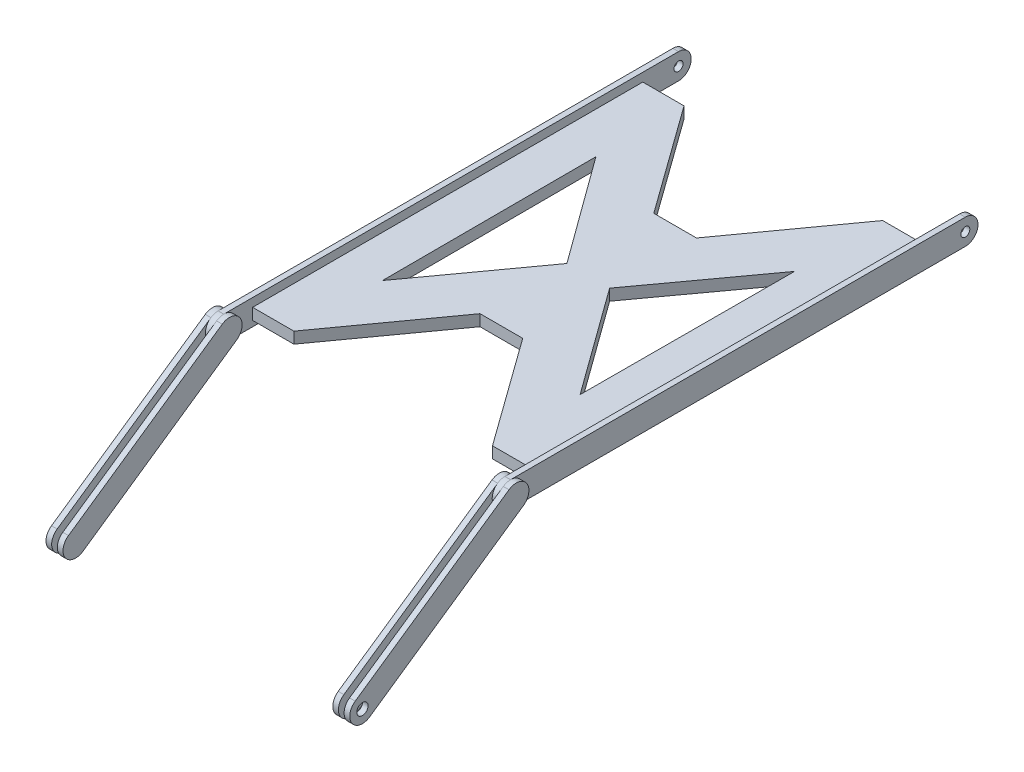
from build123d import *

# Parameters (mm, degrees)
BOSS_EXTRUDE1_DEPTH  = 6.35
BOSS_EXTRUDE2_DEPTH  = 3.175
BOSS_EXTRUDE3_DEPTH  = 3.175
SKETCH6_R            = 3.175
CUT_EXTRUDE1_DEPTH   = 283.34881494
MIRROR4_COPY_1_DEPTH = 3.175
SKETCH7_R            = 2.54
CUT_EXTRUDE2_DEPTH   = 283.34881494


with BuildPart() as part:
    # Sketch3 → Boss-Extrude1 (new body)
    with BuildSketch(Plane(origin=(0, 0, 0), x_dir=(1, 0, 0), z_dir=(0, 1, 0))):
        Polygon((-78.779496576, 109.348374591), (-78.779496576, -109.348374591), (-55.662733102, -109.348374591), (-11.971276007, -48.703282599), (11.971276007, -48.703282599), (55.662733102, -109.348374591), (78.779496576, -109.348374591), (78.779496576, 109.348374591), (55.662733102, 109.348374591), (11.971276007, 48.703282599), (-11.971276007, 48.703282599), (-55.662733102, 109.348374591), align=None)
        Polygon((-11.971276007, 0), (-55.378618761, -59.954544833), (-55.662733102, 59.954544833), align=None, mode=Mode.SUBTRACT)
        Polygon((11.971276007, 0), (55.662733102, 59.954544833), (55.378618761, -59.954544833), align=None, mode=Mode.SUBTRACT)
    extrude(amount=BOSS_EXTRUDE1_DEPTH)

    # Sketch4 → Boss-Extrude2 (add)
    with BuildSketch(Plane(origin=(78.779496576, 0, 0), x_dir=(0, 0, -1), z_dir=(1, 0, 0))):
        with BuildLine():
            Line((-125.508834583, 11.113906265), (129.384720174, 11.113906265))
            ThreePointArc((129.384720174, 11.113906265), (136.501721079, 3.99690536), (129.384720174, -3.120095546))
            Line((129.384720174, -3.120095546), (-125.508834583, -3.120095546))
            ThreePointArc((-125.508834583, -3.120095546), (-132.625835488, 3.99690536), (-125.508834583, 11.113906265))
        make_face()
    boss_extrude2 = extrude(amount=BOSS_EXTRUDE2_DEPTH)

    # Mirror1: Boss-Extrude2 across plane
    add(boss_extrude2.mirror(Plane(origin=(0, 0, 0), x_dir=(0, 0, 1), z_dir=(1, 0, 0))))

    # Sketch5 → Boss-Extrude3 (add)
    with BuildSketch(Plane(origin=(81.954496576, 0, 0), x_dir=(0, 0, -1), z_dir=(1, 0, 0))):
        with BuildLine():
            Line((-121.468100538, -1.855701955), (-207.665903416, -61.368048827))
            ThreePointArc((-207.665903416, -61.368048827), (-217.559244776, -59.556175556), (-215.747371505, -49.662834197))
            Line((-215.747371505, -49.662834197), (-129.549568627, 9.849512675))
            ThreePointArc((-129.549568627, 9.849512675), (-119.656227268, 8.037639404), (-121.468100538, -1.855701955))
        make_face()
    boss_extrude3 = extrude(amount=BOSS_EXTRUDE3_DEPTH)

    # Sketch6 → Cut-Extrude1 (cut, through all)
    with BuildSketch(Plane(origin=(85.129496576, 0, 0), x_dir=(0, 0, -1), z_dir=(1, 0, 0))):
        with Locations((-211.706637461, -55.515441512)):
            Circle(SKETCH6_R)
    extrude(amount=-CUT_EXTRUDE1_DEPTH, mode=Mode.SUBTRACT)

    # Mirror3: Boss-Extrude3 across plane
    add(boss_extrude3.mirror(Plane(origin=(80.366996576, 0, 0), x_dir=(0, 0, 1), z_dir=(1, 0, 0))))

    # Mirror4: Boss-Extrude3 across plane
    add(boss_extrude3.mirror(Plane(origin=(0, 0, 0), x_dir=(0, 0, 1), z_dir=(1, 0, 0))))

    # Mirror4 copy 1 sketch → Mirror4 copy 1 (add)
    with BuildSketch(Plane(origin=(-78.779496576, 0, 0), x_dir=(0, 0, -1), z_dir=(1, 0, 0))):
        with BuildLine():
            Line((-121.468100538, -1.855701955), (-207.665903416, -61.368048827))
            ThreePointArc((-207.665903416, -61.368048827), (-217.559244776, -59.556175556), (-215.747371505, -49.662834197))
            Line((-215.747371505, -49.662834197), (-129.549568627, 9.849512675))
            ThreePointArc((-129.549568627, 9.849512675), (-119.656227268, 8.037639404), (-121.468100538, -1.855701955))
        make_face()
    extrude(amount=MIRROR4_COPY_1_DEPTH)

    # Sketch7 → Cut-Extrude2 (cut, through all)
    with BuildSketch(Plane(origin=(81.954496576, 0, 0), x_dir=(0, 0, -1), z_dir=(1, 0, 0))):
        with Locations((129.384720174, 3.99690536)):
            Circle(SKETCH7_R)
    extrude(amount=-CUT_EXTRUDE2_DEPTH, mode=Mode.SUBTRACT)


solid = part.part
